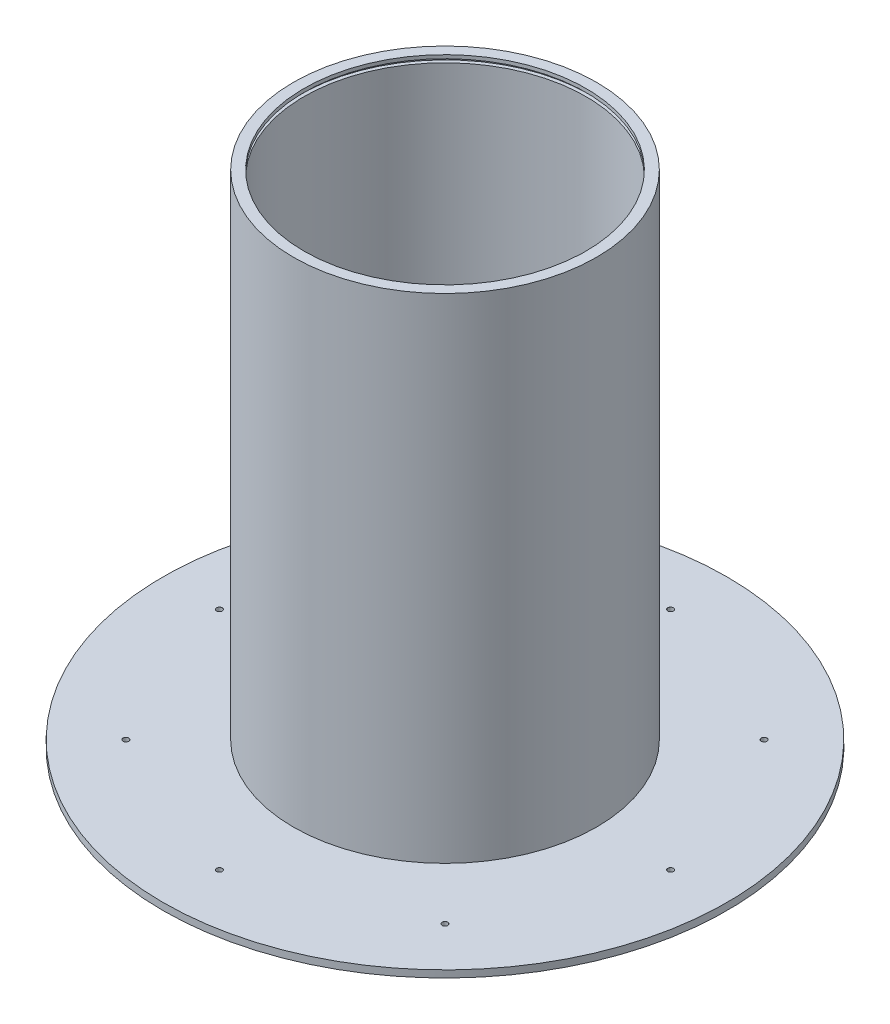
from build123d import *

# Parameters (mm, degrees)
BOSS_EXTRUDE1_DEPTH             = 155
BOSS_EXTRUDE1_DEPTH_BACK        = 200
SKETCH1_R                       = 107.5
SKETCH1_R_2                     = 100
SKETCH1_3_R                     = 100
SKETCH1_3_R_2                   = 95
SKETCH1_3_R_3                   = 31
BOSS_EXTRUDE2_DEPTH             = 17
SKETCH1_5_R                     = 95
SKETCH1_5_R_2                   = 31
CUT_EXTRUDE1_DEPTH              = 4
F_4_0MM_DOWEL_HOLE1_D           = 4
F_4_0MM_DOWEL_HOLE1_CSINK_D     = 4.05
F_4_0MM_DOWEL_HOLE1_CSINK_ANGLE = 90
CUT_EXTRUDE2_DEPTH              = 5
SKETCH8_R                       = 200
SKETCH8_R_2                     = 100
BOSS_EXTRUDE3_DEPTH             = 5
F_4_0MM_DOWEL_HOLE2_D           = 4
F_4_0MM_DOWEL_HOLE2_CSINK_D     = 4.05
F_4_0MM_DOWEL_HOLE2_CSINK_ANGLE = 90
SKETCH12_R                      = 102.5
CUT_EXTRUDE3_DEPTH              = 2.5


with BuildPart() as part:
    # Sketch1 → Boss-Extrude1 (new, two sides: drawn at the far end of the back side and taken through both)
    with BuildSketch(Plane(origin=(0, 0, 0), x_dir=(1, 0, 0), z_dir=(0, 1, 0)).offset(-BOSS_EXTRUDE1_DEPTH_BACK)):
        with Locations(Location((0, 0, 0), (0, 0, 270))):
            Circle(SKETCH1_R)
        with Locations(Location((0, 0, 0), (0, 0, 270))):
            Circle(SKETCH1_R_2, mode=Mode.SUBTRACT)
    extrude(amount=BOSS_EXTRUDE1_DEPTH + BOSS_EXTRUDE1_DEPTH_BACK)

    # Sketch1<3> → Boss-Extrude2 (add)
    # profile 1 of 2: a face of its own
    with BuildSketch(Plane(origin=(0, 0, 0), x_dir=(1, 0, 0), z_dir=(0, 1, 0))):
        with Locations(Location((0, 0, 0), (0, 0, 270))):
            Circle(SKETCH1_3_R)
        Circle(SKETCH1_3_R_2, mode=Mode.SUBTRACT)
    # profile 2 of 2: a face of its own
    with BuildSketch(Plane(origin=(0, 0, 0), x_dir=(1, 0, 0), z_dir=(0, 1, 0))):
        Circle(SKETCH1_3_R_2)
        with Locations(Location((0, 0, 0), (0, 0, 270))):
            Circle(SKETCH1_3_R_3, mode=Mode.SUBTRACT)
    extrude(amount=-BOSS_EXTRUDE2_DEPTH)

    # Sketch1<5> → Cut-Extrude1 (cut)
    with BuildSketch(Plane(origin=(0, 0, 0), x_dir=(1, 0, 0), z_dir=(0, 1, 0))):
        with Locations(Location((0, 0, 0), (0, 0, 270))):
            Circle(SKETCH1_5_R)
        with Locations(Location((0, 0, 0), (0, 0, 270))):
            Circle(SKETCH1_5_R_2, mode=Mode.SUBTRACT)
    extrude(amount=-CUT_EXTRUDE1_DEPTH, mode=Mode.SUBTRACT)

    # Ø4.0mm Dowel Hole1 (through all)
    with Locations(Plane(origin=(0, -17, 0), x_dir=(-1, 0, 0), z_dir=(0, -1, 0))):
        with Locations((0, 70), (49.497474683, 49.497474683), (-49.497474683, 49.497474683), (-70, 0), (-49.497474683, -49.497474683), (0, -70), (49.497474683, -49.497474683), (70, 0)):
            CounterSinkHole(F_4_0MM_DOWEL_HOLE1_D / 2, F_4_0MM_DOWEL_HOLE1_CSINK_D / 2, counter_sink_angle=F_4_0MM_DOWEL_HOLE1_CSINK_ANGLE)

    # Sketch5 → Cut-Extrude2 (cut)
    with BuildSketch(Plane(origin=(0, -4, 0), x_dir=(1, 0, 0), z_dir=(0, 1, 0))):
        Polygon((46.231488359, 46.231488359), (50.692908646, 45.036054396), (53.95889497, 48.30204072), (52.763461007, 52.763461007), (48.30204072, 53.95889497), (45.036054396, 50.692908646), align=None)
        Polygon((0, 65.381197846), (4, 67.690598923), (4, 72.309401077), (0, 74.618802154), (-4, 72.309401077), (-4, 67.690598923), align=None)
        Polygon((65.381197846, 0), (67.690598923, -4), (72.309401077, -4), (74.618802154, 0), (72.309401077, 4), (67.690598923, 4), align=None)
        Polygon((46.231488359, -46.231488359), (45.036054396, -50.692908646), (48.30204072, -53.95889497), (52.763461007, -52.763461007), (53.95889497, -48.30204072), (50.692908646, -45.036054396), align=None)
        Polygon((0, -65.381197846), (-4, -67.690598923), (-4, -72.309401077), (0, -74.618802154), (4, -72.309401077), (4, -67.690598923), align=None)
        Polygon((-46.231488359, -46.231488359), (-50.692908646, -45.036054396), (-53.95889497, -48.30204072), (-52.763461007, -52.763461007), (-48.30204072, -53.95889497), (-45.036054396, -50.692908646), align=None)
        Polygon((-65.381197846, 0), (-67.690598923, 4), (-72.309401077, 4), (-74.618802154, 0), (-72.309401077, -4), (-67.690598923, -4), align=None)
        Polygon((-46.231488359, 46.231488359), (-45.036054396, 50.692908646), (-48.30204072, 53.95889497), (-52.763461007, 52.763461007), (-53.95889497, 48.30204072), (-50.692908646, 45.036054396), align=None)
    extrude(amount=-CUT_EXTRUDE2_DEPTH, mode=Mode.SUBTRACT)

    # Sketch8 → Boss-Extrude3 (add)
    with BuildSketch(Plane(origin=(0, -200, 0), x_dir=(-1, 0, 0), z_dir=(0, -1, 0))):
        with Locations(Location((0, 0, 0), (0, 0, 90))):
            Circle(SKETCH8_R)
        with Locations(Location((0, 0, 0), (0, 0, 270))):
            Circle(SKETCH8_R_2, mode=Mode.SUBTRACT)
    extrude(amount=-BOSS_EXTRUDE3_DEPTH)

    # Ø4.0mm Dowel Hole2 (through all)
    with Locations(Plane(origin=(0, -195, 0), x_dir=(1, 0, 0), z_dir=(0, 1, 0))):
        with Locations((160, 0), (113.13708499, 113.13708499), (0, 160), (-113.13708499, 113.13708499), (-160, 0), (-113.13708499, -113.13708499), (113.13708499, -113.13708499), (0, -160)):
            CounterSinkHole(F_4_0MM_DOWEL_HOLE2_D / 2, F_4_0MM_DOWEL_HOLE2_CSINK_D / 2, counter_sink_angle=F_4_0MM_DOWEL_HOLE2_CSINK_ANGLE)

    # Sketch12 → Cut-Extrude3 (cut)
    with BuildSketch(Plane(origin=(0, 150, 0), x_dir=(1, 0, 0), z_dir=(0, 1, 0))):
        with Locations(Location((0, 0, 0), (0, 0, 270))):
            Circle(SKETCH12_R)
    extrude(amount=CUT_EXTRUDE3_DEPTH, mode=Mode.SUBTRACT)


solid = part.part
